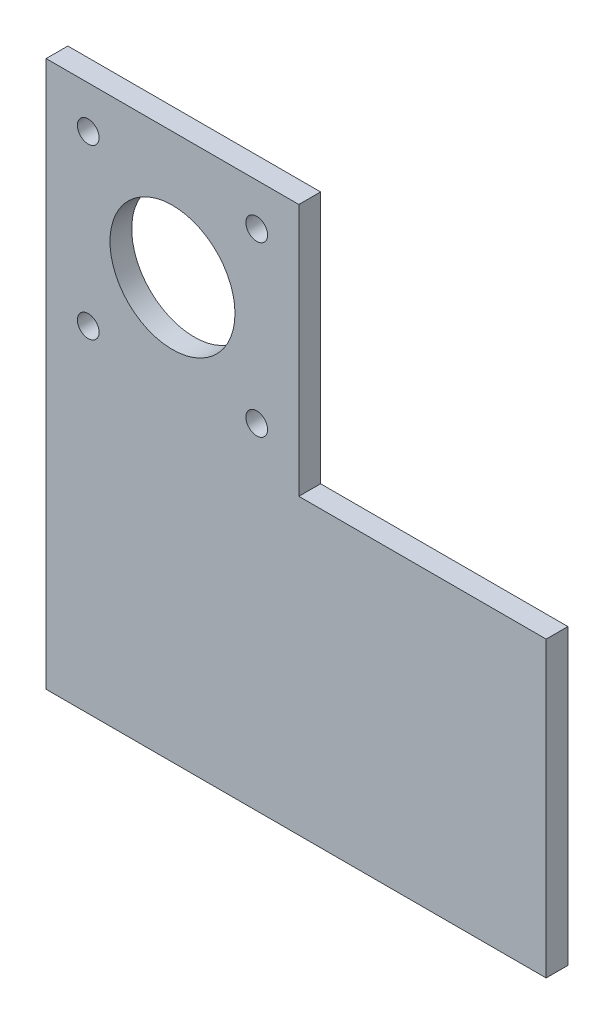
from build123d import *

# Parameters (mm, degrees)
SKETCH1_R           = 11.5
SKETCH1_R_2         = 2
BOSS_EXTRUDE1_DEPTH = 4


with BuildPart() as part:
    # Sketch1 → Boss-Extrude1 (new body)
    with BuildSketch(Plane.XY):
        Polygon((0, 0), (0, 100.5), (46.5, 100.5), (46.5, 54), (92, 54), (92, 0), align=None)
        with Locations((23.25, 77.25)):
            Circle(SKETCH1_R, mode=Mode.SUBTRACT)
        with Locations((7.750001854, 92.749998146)):
            Circle(SKETCH1_R_2, mode=Mode.SUBTRACT)
        with Locations((38.750001854, 92.750001854)):
            Circle(SKETCH1_R_2, mode=Mode.SUBTRACT)
        with Locations((38.749998146, 61.750001854)):
            Circle(SKETCH1_R_2, mode=Mode.SUBTRACT)
        with Locations((7.749998146, 61.749998146)):
            Circle(SKETCH1_R_2, mode=Mode.SUBTRACT)
    extrude(amount=BOSS_EXTRUDE1_DEPTH)


solid = part.part
